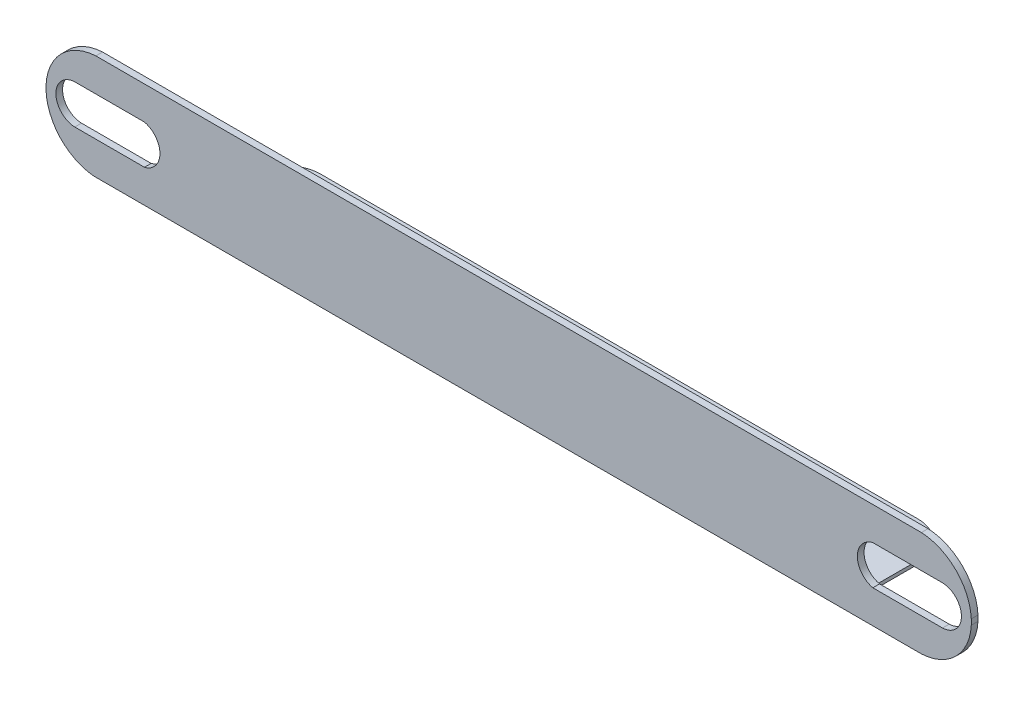
from build123d import *

# Parameters (mm, degrees)
SKETCH1_W           = 351.028
SKETCH1_H           = 39.878
BOSS_EXTRUDE1_DEPTH = 2.54
CUT_EXTRUDE1_DEPTH  = 2.54
BOSS_EXTRUDE3_DEPTH = 1.27
CUT_EXTRUDE2_DEPTH  = 182.08885497


with BuildPart() as part:
    # Sketch1 → Boss-Extrude1 (new body)
    with BuildSketch(Plane.XY):
        Rectangle(SKETCH1_W, SKETCH1_H)
    extrude(amount=BOSS_EXTRUDE1_DEPTH)

    # Sketch2 → Cut-Extrude1 (cut)
    with BuildSketch(Plane.XY.offset(2.54)):
        with BuildLine():
            ThreePointArc((-175.514, 0.560558273), (-169.838630059, 13.933642373), (-156.610444921, 19.939))
            Line((-156.610444921, 19.939), (-175.514, 19.939))
            Line((-175.514, 19.939), (-175.514, 0.560558273))
        make_face()
        with BuildLine():
            ThreePointArc((-157.487509507, -19.939), (-170.14228569, -13.682666917), (-175.514, -0.627792376))
            Line((-175.514, -0.627792376), (-175.514, -19.939))
            Line((-175.514, -19.939), (-157.487509507, -19.939))
        make_face()
        with BuildLine():
            Line((175.514, 19.939), (156.589507007, 19.939))
            ThreePointArc((156.589507007, 19.939), (169.681715457, 14.129412549), (175.514, 1.047299362))
            Line((175.514, 1.047299362), (175.514, 19.939))
        make_face()
        with BuildLine():
            Line((175.514, -19.939), (175.514, -1.047299362))
            ThreePointArc((175.514, -1.047299362), (169.681715457, -14.129412549), (156.589507007, -19.939))
            Line((156.589507007, -19.939), (175.514, -19.939))
        make_face()
    extrude(amount=-CUT_EXTRUDE1_DEPTH, mode=Mode.SUBTRACT)

    # Sketch4 → Boss-Extrude3 (add)
    with BuildSketch(Plane(origin=(0, -19.939, 0), x_dir=(-1, 0, 0), z_dir=(0, -1, 0))):
        with BuildLine():
            Line((-126.490507007, 27.129664964), (-126.490507007, 0))
            Line((-126.490507007, 0), (127.388509507, 0))
            Line((127.388509507, 0), (127.388509507, 26.231634315))
            ThreePointArc((127.388509507, 26.231634315), (123.395271006, 35.875988979), (113.754553273, 39.878))
            Line((113.754553273, 39.878), (-112.615934561, 39.878))
            ThreePointArc((-112.615934561, 39.878), (-122.105920459, 36.282047556), (-126.490507007, 27.129664964))
        make_face()
    extrude(amount=-BOSS_EXTRUDE3_DEPTH)

    # Sketch5 → Cut-Extrude2 (cut, through all)
    with BuildSketch(Plane(origin=(0, 0, 0), x_dir=(-1, 0, 0), z_dir=(0, 0, -1))):
        with BuildLine():
            Line((-164.606102616, 7.415708173), (-138.164214663, 7.415708173))
            ThreePointArc((-138.164214663, 7.415708173), (-132.284701758, -0.002856694), (-138.164214663, -7.42142156))
            Line((-138.164214663, -7.42142156), (-164.606102616, -7.42142156))
            ThreePointArc((-164.606102616, -7.42142156), (-171.773613025, -0.002856694), (-164.606102616, 7.415708173))
        make_face()
    cut_extrude2 = extrude(amount=-CUT_EXTRUDE2_DEPTH, mode=Mode.SUBTRACT)

    # Mirror1: Cut-Extrude2 across plane
    add(cut_extrude2.mirror(Plane(origin=(0, 0, 0), x_dir=(0, 0, 1), z_dir=(1, 0, 0))), mode=Mode.SUBTRACT)


solid = part.part
